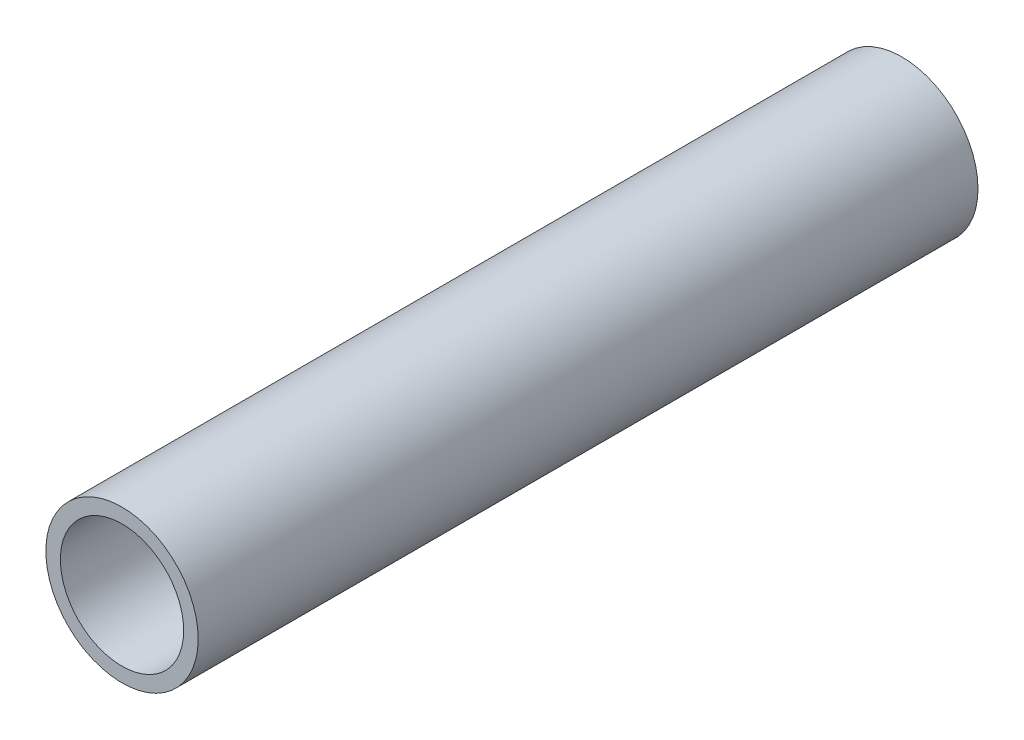
from build123d import *

# Parameters (mm, degrees)
SKETCH_1_R      = 21
SKETCH_1_R_2    = 17
EXTRUDE_1_DEPTH = 215


with BuildPart() as part:
    # Эскиз1 → Бобышка-Вытянуть1 (new body)
    with BuildSketch(Plane.XY):
        Circle(SKETCH_1_R)
        Circle(SKETCH_1_R_2, mode=Mode.SUBTRACT)
    extrude(amount=EXTRUDE_1_DEPTH)


solid = part.part
